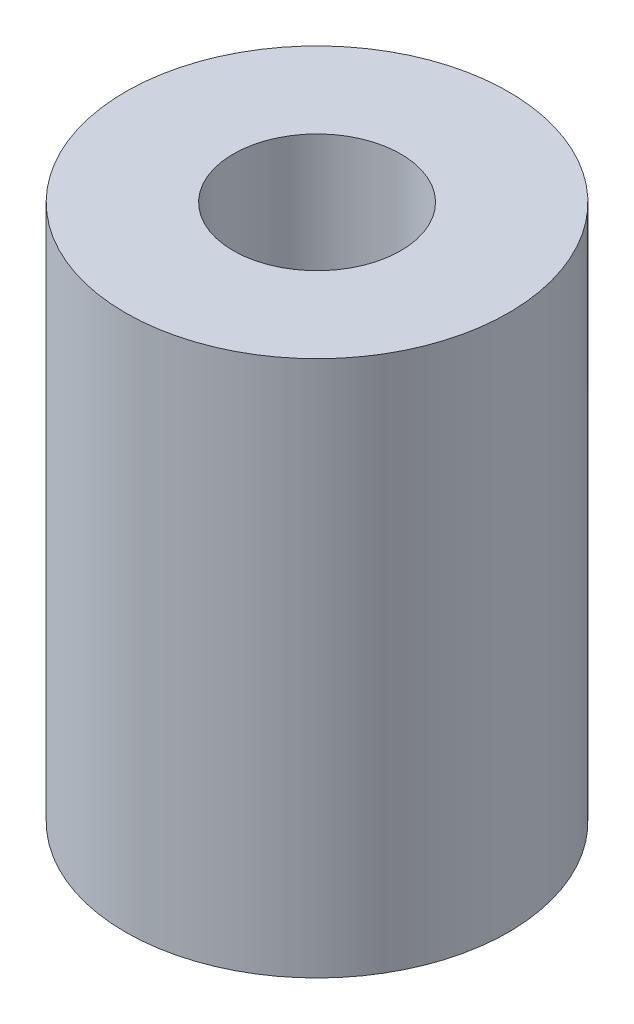
from build123d import *

# Parameters (mm, degrees)
SKETCH_1_R      = 4
SKETCH_1_R_2    = 1.75
EXTRUDE_1_DEPTH = 11.2


with BuildPart() as part:
    # 草图1 → 凸台-拉伸1 (new body)
    with BuildSketch(Plane(origin=(0, 0, 0), x_dir=(1, 0, 0), z_dir=(0, 1, 0))):
        with Locations(Location((0, 0, 0), (0, 0, 270))):
            Circle(SKETCH_1_R)
        with Locations(Location((0, 0, 0), (0, 0, 270))):
            Circle(SKETCH_1_R_2, mode=Mode.SUBTRACT)
    extrude(amount=EXTRUDE_1_DEPTH)


solid = part.part
